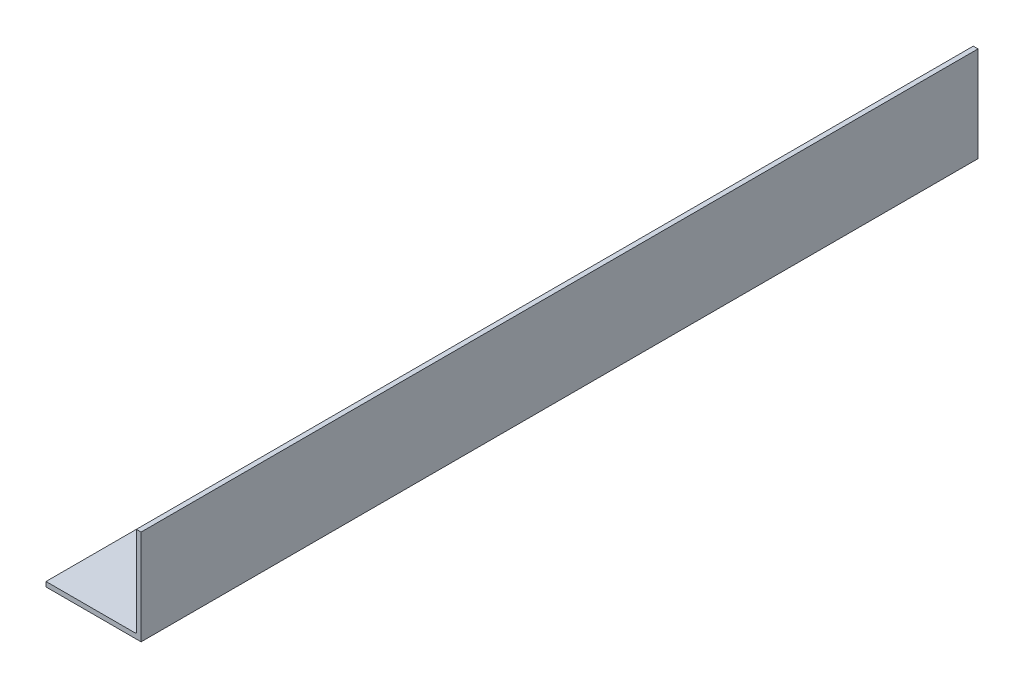
from build123d import *

# Parameters (mm, degrees)
BOSS_EXTRUDE1_DEPTH = 139.7


with BuildPart() as part:
    # Sketch2 → Boss-Extrude1 (new, symmetric)
    with BuildSketch(Plane.XY):
        with BuildLine():
            Line((-15.875, 0), (15.875, 0))
            Line((15.875, 0), (15.875, 31.75))
            Line((15.875, 31.75), (14.2875, 31.75))
            Line((14.2875, 31.75), (14.2875, 1.9685))
            ThreePointArc((14.2875, 1.9685), (14.175907684, 1.699092316), (13.9065, 1.5875))
            Line((13.9065, 1.5875), (-15.875, 1.5875))
            Line((-15.875, 1.5875), (-15.875, 0))
        make_face()
    extrude(amount=BOSS_EXTRUDE1_DEPTH, both=True)


solid = part.part
